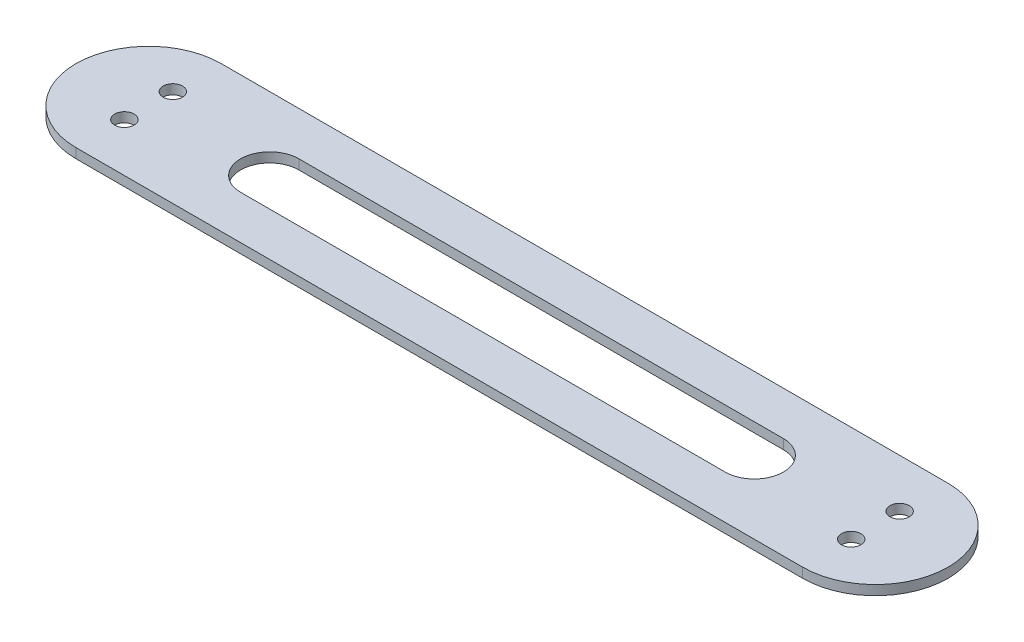
from build123d import *

# Parameters (mm, degrees)
EXTRUDE_1_DEPTH     = 2
SKETCH_2_R          = 2
CUT_EXTRUDE_1_DEPTH = 2


with BuildPart() as part:
    # 草图1 → 凸台-拉伸1 (new body)
    with BuildSketch(Plane(origin=(0, 0, 0), x_dir=(1, 0, 0), z_dir=(0, 1, 0))):
        with BuildLine():
            Line((-75, 15), (75, 15))
            ThreePointArc((75, 15), (90, 0), (75, -15))
            Line((75, -15), (-75, -15))
            ThreePointArc((-75, -15), (-90, 0), (-75, 15))
        make_face()
    extrude(amount=EXTRUDE_1_DEPTH)

    # 草图2 → 切除-拉伸1 (cut)
    with BuildSketch(Plane(origin=(0, 2, 0), x_dir=(1, 0, 0), z_dir=(0, 1, 0))):
        with Locations(Location((-75, 5, 0), (0, 0, 270))):
            Circle(SKETCH_2_R)
        with Locations(Location((-75, -5, 0), (0, 0, 90))):
            Circle(SKETCH_2_R)
        with Locations(Location((75, -5, 0), (0, 0, 270))):
            Circle(SKETCH_2_R)
        with Locations(Location((75, 5, 0), (0, 0, 90))):
            Circle(SKETCH_2_R)
        with BuildLine():
            Line((-50, 6), (50, 6))
            ThreePointArc((50, 6), (56, 0), (50, -6))
            Line((50, -6), (-50, -6))
            ThreePointArc((-50, -6), (-56, 0), (-50, 6))
        make_face()
    extrude(amount=-CUT_EXTRUDE_1_DEPTH, mode=Mode.SUBTRACT)


solid = part.part
